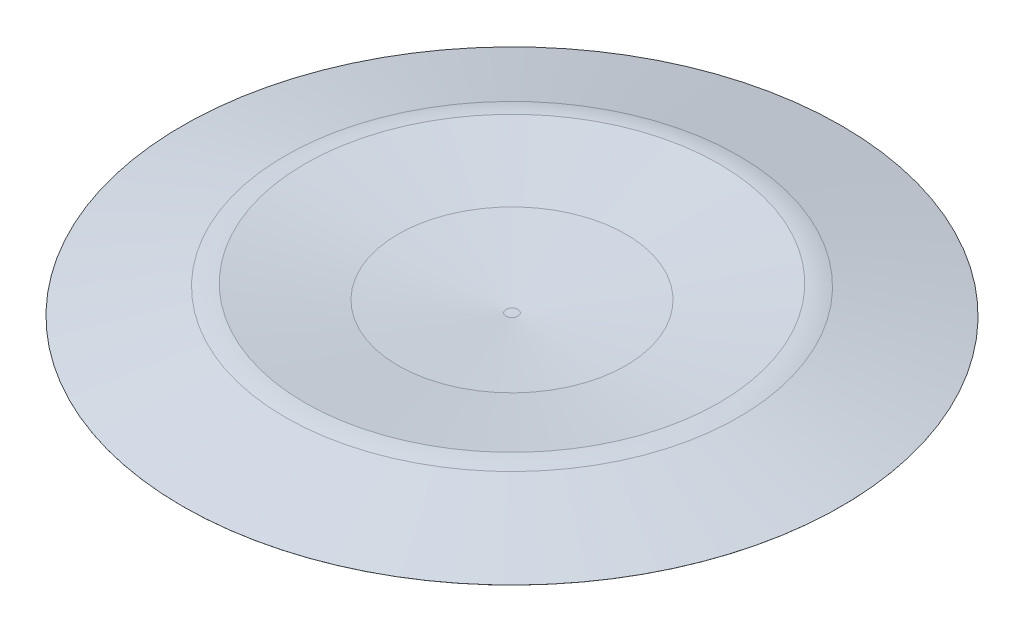
from build123d import *


with BuildPart() as part:
    # Schizzo1 → Rivoluzione1 (revolve)
    with BuildSketch(Plane(origin=(0, 0, 0), x_dir=(-1, 0, 0), z_dir=(0, 0, 1)), mode=Mode.PRIVATE) as rivoluzione1_sk:
        with BuildLine():
            Line((-554.694489339, -544.755446129), (-379.995479902, -588.120248731))
            ThreePointArc((-379.995479902, -588.120248731), (-363.473567073, -591.36496946), (-346.694145738, -592.762408471))
            Line((-346.694145738, -592.762408471), (-188.558838555, -568.406205519))
            Line((-188.558838555, -568.406205519), (-5.145007861, -549.45847961))
            Line((-5.145007861, -549.45847961), (4.842484317, -549.45847961))
            Line((4.842484317, -549.45847961), (4.842484317, -549.55847961))
            Line((4.842484317, -549.55847961), (-5.139856275, -549.55847961))
            Line((-5.139856275, -549.55847961), (-188.546081358, -568.505419815))
            Line((-188.546081358, -568.505419815), (-346.687865577, -592.862620368))
            ThreePointArc((-346.687865577, -592.862620368), (-363.482742045, -591.464657333), (-380.01986383, -588.217230765))
            Line((-380.01986383, -588.217230765), (-554.718580803, -544.852500759))
            Line((-554.718580803, -544.852500759), (-554.694489339, -544.755446129))
        make_face()
    revolve(rivoluzione1_sk.sketch.rotate(Axis((-4.842484317, 549.239933768, 0), (0, 1, 0)), 90), axis=Axis((-4.842484317, 549.239933768, 0), (0, 1, 0)))


solid = part.part
